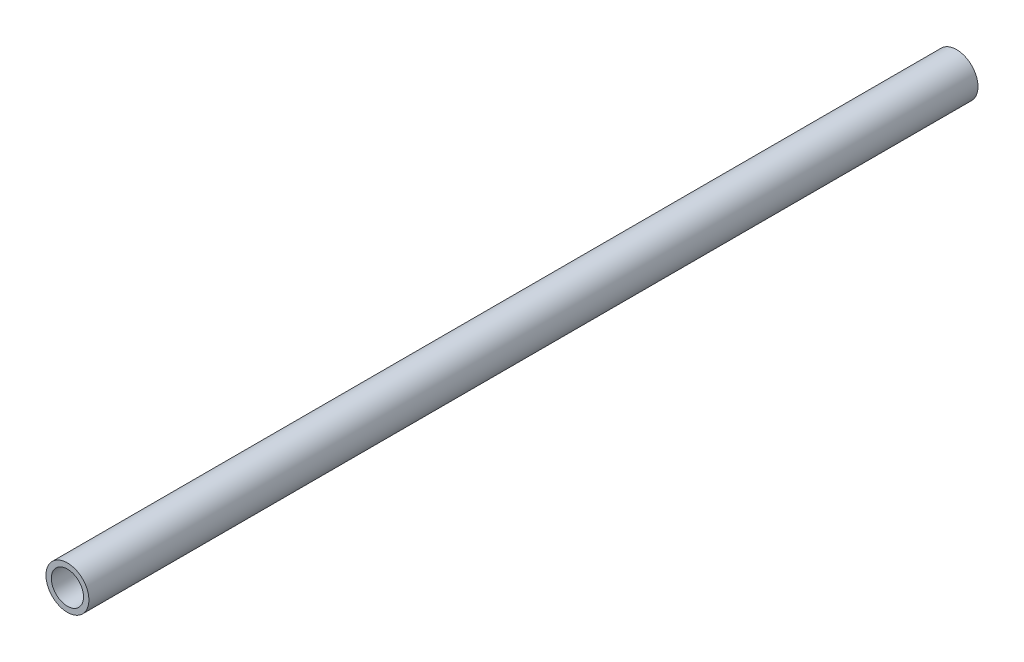
from build123d import *

# Parameters (mm, degrees)
SKETCH2_R           = 12.7
SKETCH2_R_2         = 9.525
BOSS_EXTRUDE1_DEPTH = 263.06907


with BuildPart() as part:
    # Sketch2 → Boss-Extrude1 (new, symmetric)
    with BuildSketch(Plane.XY):
        Circle(SKETCH2_R)
        Circle(SKETCH2_R_2, mode=Mode.SUBTRACT)
    extrude(amount=BOSS_EXTRUDE1_DEPTH, both=True)


solid = part.part
